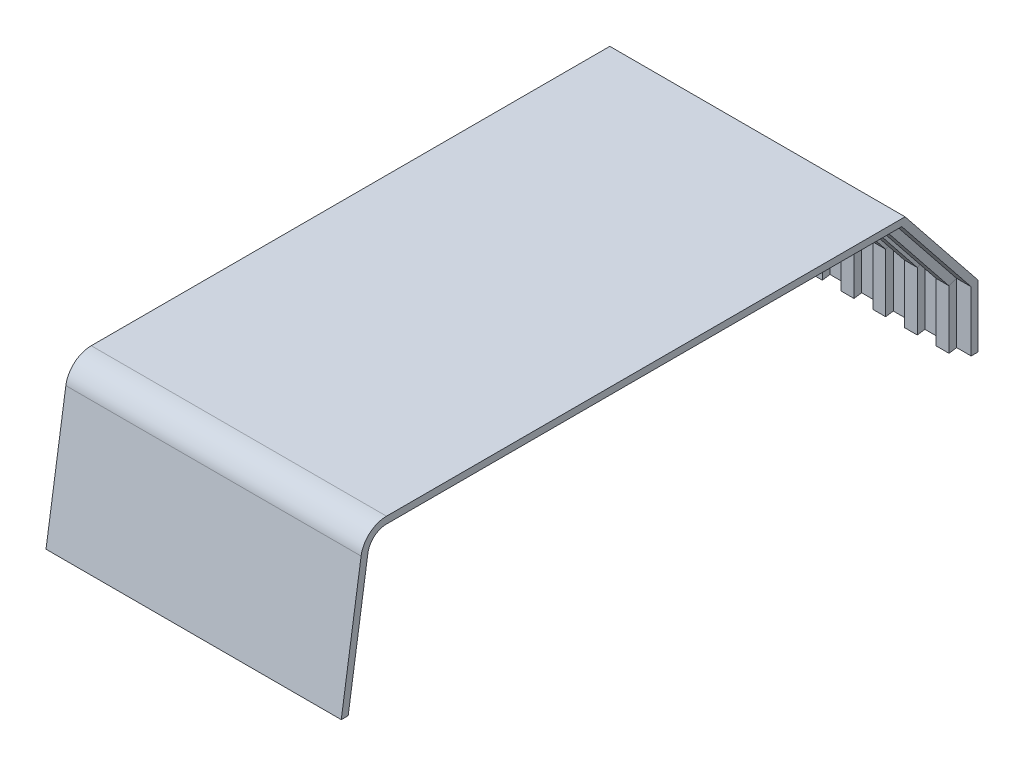
from build123d import *

# Parameters (mm, degrees)
EXTRUDE_1_DEPTH = 69
SKETCH_7_W      = 3
SKETCH_7_H      = 1.8


with BuildPart() as part:
    # 草图2 → 凸台-拉伸1 (new body)
    with BuildSketch(Plane(origin=(0, 0, 0), x_dir=(0, 0, -1), z_dir=(1, 0, 0))):
        with BuildLine():
            Line((-2.001625282, 3.147074334), (-2.001625282, 17.164444968))
            Line((-2.001625282, 17.164444968), (-18.214026207, 37.447074334))
            Line((-18.214026207, 37.447074334), (-138.628938569, 37.447074334))
            ThreePointArc((-138.628938569, 37.447074334), (-141.499289796, 36.38190324), (-142.979906861, 33.70211244))
            Line((-142.979906861, 33.70211244), (-147.579966657, 3.147074334))
            Line((-147.579966657, 3.147074334), (-149.197997295, 3.147074334))
            Line((-149.197997295, 3.147074334), (-144.562077149, 33.940308116))
            ThreePointArc((-144.562077149, 33.940308116), (-142.543053879, 37.594568297), (-138.628938569, 39.047074334))
            Line((-138.628938569, 39.047074334), (-17.444620599, 39.047074334))
            Line((-17.444620599, 39.047074334), (-0.401625282, 17.725324466))
            Line((-0.401625282, 17.725324466), (-0.401625282, 3.147074334))
            Line((-0.401625282, 3.147074334), (-2.001625282, 3.147074334))
        make_face()
    extrude(amount=EXTRUDE_1_DEPTH)

    # 扫描1: sweep along a path in 草图17
    with BuildLine(Plane.ZY) as sweep_1_path:
        Line((147.579966657, 3.147074334), (143.056789207, 33.191435819))
        ThreePointArc((143.056789207, 33.191435819), (141.374269815, 36.236652636), (138.112507057, 37.447074334))
        Line((138.112507057, 37.447074334), (18.214026207, 37.447074334))
        Line((18.214026207, 37.447074334), (2.001625282, 17.164444968))
        Line((2.001625282, 17.164444968), (2.001625282, 3.147074334))
    # 草图7 → 扫描1 (sweep)
    with BuildSketch(Plane.XZ.offset(-3.147074334)):
        with Locations((34.5, 146.679966657)):
            Rectangle(SKETCH_7_W, SKETCH_7_H)
        with Locations((27.1, 146.679966657)):
            Rectangle(SKETCH_7_W, SKETCH_7_H)
        with Locations((19.7, 146.679966657)):
            Rectangle(SKETCH_7_W, SKETCH_7_H)
        with Locations((12.3, 146.679966657)):
            Rectangle(SKETCH_7_W, SKETCH_7_H)
        with Locations((4.9, 146.679966657)):
            Rectangle(SKETCH_7_W, SKETCH_7_H)
        with Locations((41.9, 146.679966657)):
            Rectangle(SKETCH_7_W, SKETCH_7_H)
        with Locations((49.3, 146.679966657)):
            Rectangle(SKETCH_7_W, SKETCH_7_H)
        with Locations((56.7, 146.679966657)):
            Rectangle(SKETCH_7_W, SKETCH_7_H)
        with Locations((64.1, 146.679966657)):
            Rectangle(SKETCH_7_W, SKETCH_7_H)
    sweep(path=sweep_1_path.line, transition=Transition.RIGHT)


solid = part.part
